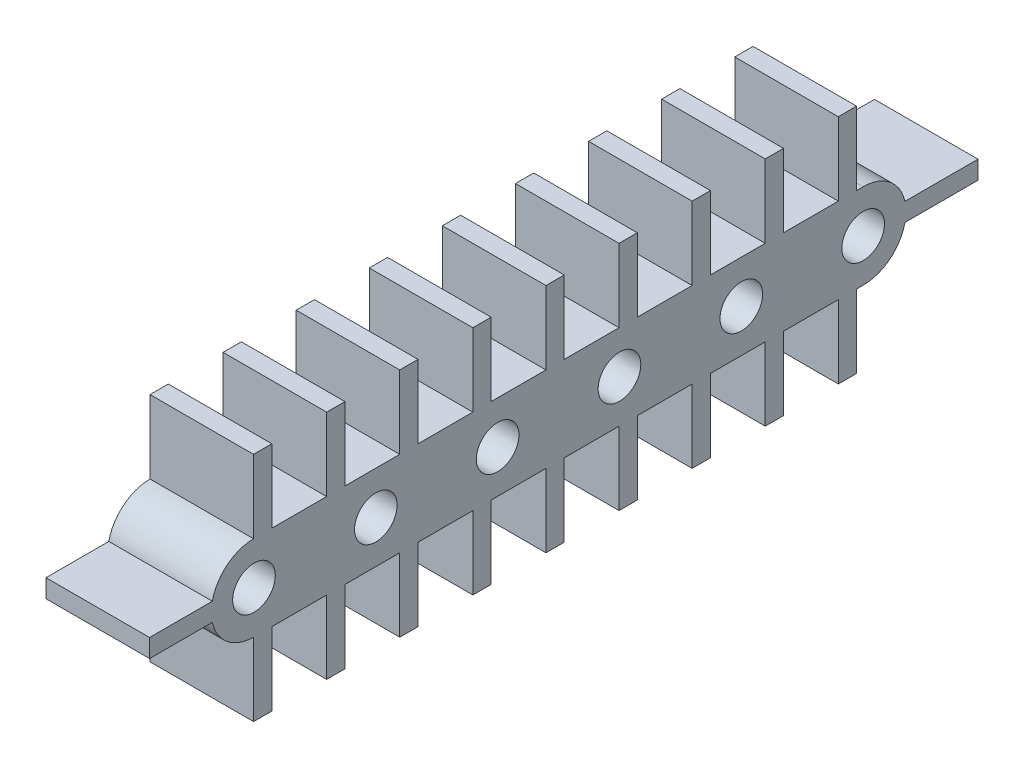
from build123d import *

# Parameters (mm, degrees)
SKETCH1_R           = 17.5
BOSS_EXTRUDE1_DEPTH = 85


with BuildPart() as part:
    # Sketch1 → Boss-Extrude1 (new body)
    with BuildSketch(Plane(origin=(0, 0, 0), x_dir=(0, 0, -1), z_dir=(1, 0, 0))):
        with BuildLine():
            Line((-250.081967213, 35), (-205.081967213, 35))
            Line((-205.081967213, 35), (-205.081967213, 95))
            Line((-205.081967213, 95), (-190.081967213, 95))
            Line((-190.081967213, 95), (-190.081967213, 35))
            Line((-190.081967213, 35), (-185.081967213, 35))
            Line((-185.081967213, 35), (-145.081967213, 35))
            Line((-145.081967213, 35), (-145.081967213, 95))
            Line((-145.081967213, 95), (-130.081967213, 95))
            Line((-130.081967213, 95), (-130.081967213, 35))
            Line((-130.081967213, 35), (-85.081967213, 35))
            Line((-85.081967213, 35), (-85.081967213, 95))
            Line((-85.081967213, 95), (-70.081967213, 95))
            Line((-70.081967213, 95), (-70.081967213, 35))
            Line((-70.081967213, 35), (-25.081967213, 35))
            Line((-25.081967213, 35), (-25.081967213, 95))
            Line((-25.081967213, 95), (-10.081967213, 95))
            Line((-10.081967213, 95), (-10.081967213, 35))
            Line((-10.081967213, 35), (34.918032787, 35))
            Line((34.918032787, 35), (34.918032787, 95))
            Line((34.918032787, 95), (49.918032787, 95))
            Line((49.918032787, 95), (49.918032787, 35))
            Line((49.918032787, 35), (94.918032787, 35))
            Line((94.918032787, 35), (94.918032787, 95))
            Line((94.918032787, 95), (109.918032787, 95))
            Line((109.918032787, 95), (109.918032787, 35))
            Line((109.918032787, 35), (154.918032787, 35))
            Line((154.918032787, 35), (154.918032787, 95))
            Line((154.918032787, 95), (169.918032787, 95))
            Line((169.918032787, 95), (169.918032787, 35))
            Line((169.918032787, 35), (214.918032787, 35))
            Line((214.918032787, 35), (214.918032787, 95))
            Line((214.918032787, 95), (229.918032787, 95))
            Line((229.918032787, 95), (229.918032787, 35))
            Line((229.918032787, 35), (235.374517149, 35))
            ThreePointArc((235.374517149, 35), (257.311928117, 27.271780287), (269.561502977, 7.5))
            Line((269.561502977, 7.5), (329.561502977, 7.5))
            Line((329.561502977, 7.5), (329.561502977, -7.5))
            Line((329.561502977, -7.5), (269.561502977, -7.5))
            ThreePointArc((269.561502977, -7.5), (257.311928117, -27.271780287), (235.374517149, -35))
            Line((235.374517149, -35), (229.918032787, -35))
            Line((229.918032787, -35), (229.918032787, -95))
            Line((229.918032787, -95), (214.918032787, -95))
            Line((214.918032787, -95), (214.918032787, -35))
            Line((214.918032787, -35), (169.918032787, -35))
            Line((169.918032787, -35), (169.918032787, -95))
            Line((169.918032787, -95), (154.918032787, -95))
            Line((154.918032787, -95), (154.918032787, -35))
            Line((154.918032787, -35), (109.918032787, -35))
            Line((109.918032787, -35), (109.918032787, -95))
            Line((109.918032787, -95), (94.918032787, -95))
            Line((94.918032787, -95), (94.918032787, -35))
            Line((94.918032787, -35), (49.918032787, -35))
            Line((49.918032787, -35), (49.918032787, -95))
            Line((49.918032787, -95), (34.918032787, -95))
            Line((34.918032787, -95), (34.918032787, -35))
            Line((34.918032787, -35), (-10.081967213, -35))
            Line((-10.081967213, -35), (-10.081967213, -95))
            Line((-10.081967213, -95), (-25.081967213, -95))
            Line((-25.081967213, -95), (-25.081967213, -35))
            Line((-25.081967213, -35), (-70.081967213, -35))
            Line((-70.081967213, -35), (-70.081967213, -95))
            Line((-70.081967213, -95), (-85.081967213, -95))
            Line((-85.081967213, -95), (-85.081967213, -35))
            Line((-85.081967213, -35), (-130.081967213, -35))
            Line((-130.081967213, -35), (-130.081967213, -95))
            Line((-130.081967213, -95), (-145.081967213, -95))
            Line((-145.081967213, -95), (-145.081967213, -35))
            Line((-145.081967213, -35), (-190.081967213, -35))
            Line((-190.081967213, -35), (-190.081967213, -95))
            Line((-190.081967213, -95), (-205.081967213, -95))
            Line((-205.081967213, -95), (-205.081967213, -35))
            Line((-205.081967213, -35), (-250.081967213, -35))
            Line((-250.081967213, -35), (-250.081967213, -95))
            Line((-250.081967213, -95), (-265.081967213, -95))
            Line((-265.081967213, -95), (-265.081967213, -35))
            ThreePointArc((-265.081967213, -35), (-286.793224125, -27.156121863), (-298.898676377, -7.5))
            Line((-298.898676377, -7.5), (-350.428459553, -7.5))
            Line((-350.428459553, -7.5), (-350.428459553, 7.5))
            Line((-350.428459553, 7.5), (-298.898676377, 7.5))
            ThreePointArc((-298.898676377, 7.5), (-286.793224125, 27.156121863), (-265.081967213, 35))
            Line((-265.081967213, 35), (-265.081967213, 95))
            Line((-265.081967213, 95), (-250.081967213, 95))
            Line((-250.081967213, 95), (-250.081967213, 35))
        make_face()
        with Locations((-264.709663373, 0)):
            Circle(SKETCH1_R, mode=Mode.SUBTRACT)
        with Locations((-164.709663373, 0)):
            Circle(SKETCH1_R, mode=Mode.SUBTRACT)
        with Locations((-64.709663373, 0)):
            Circle(SKETCH1_R, mode=Mode.SUBTRACT)
        with Locations((35.290336627, 0)):
            Circle(SKETCH1_R, mode=Mode.SUBTRACT)
        with Locations((135.290336627, 0)):
            Circle(SKETCH1_R, mode=Mode.SUBTRACT)
        with Locations((235.290336627, 0)):
            Circle(SKETCH1_R, mode=Mode.SUBTRACT)
    extrude(amount=BOSS_EXTRUDE1_DEPTH)


solid = part.part
